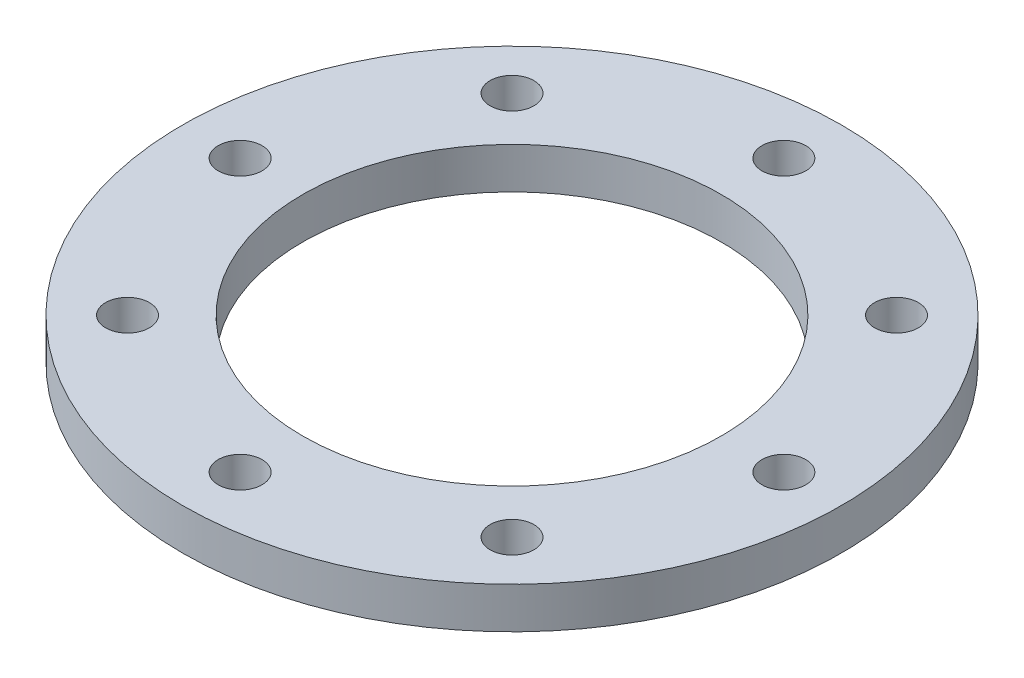
from build123d import *

# Parameters (mm, degrees)
SKETCH1_R               = 50.8
SKETCH1_R_2             = 32.258
BOSS_EXTRUDE1_DEPTH     = 6.35
F_1_4_CLEARANCE_HOLE1_D = 6.7564
CIRPATTERN1_COUNT       = 8


with BuildPart() as part:
    # Sketch1 → Boss-Extrude1 (new body)
    with BuildSketch(Plane(origin=(0, 0, 0), x_dir=(1, 0, 0), z_dir=(0, 1, 0))):
        with Locations(Location((0, 0, 0), (0, 0, 270))):
            Circle(SKETCH1_R)
        with Locations(Location((0, 0, 0), (0, 0, 270))):
            Circle(SKETCH1_R_2, mode=Mode.SUBTRACT)
    extrude(amount=BOSS_EXTRUDE1_DEPTH)

    # 1/4 Clearance Hole1 (through all)
    with Locations(Plane(origin=(0, 6.35, 0), x_dir=(1, 0, 0), z_dir=(0, 1, 0))):
        with Locations((0, 41.91)):
            f_1_4_clearance_hole1 = Hole(F_1_4_CLEARANCE_HOLE1_D / 2)

    # CirPattern1: 1/4 Clearance Hole1 ×8 about axis
    cirpattern1_axis = Axis((0, 0, 0), (0, 1, 0))
    for i in range(1, CIRPATTERN1_COUNT):
        add(f_1_4_clearance_hole1.rotate(cirpattern1_axis, i * 360 / CIRPATTERN1_COUNT), mode=Mode.SUBTRACT)


solid = part.part
